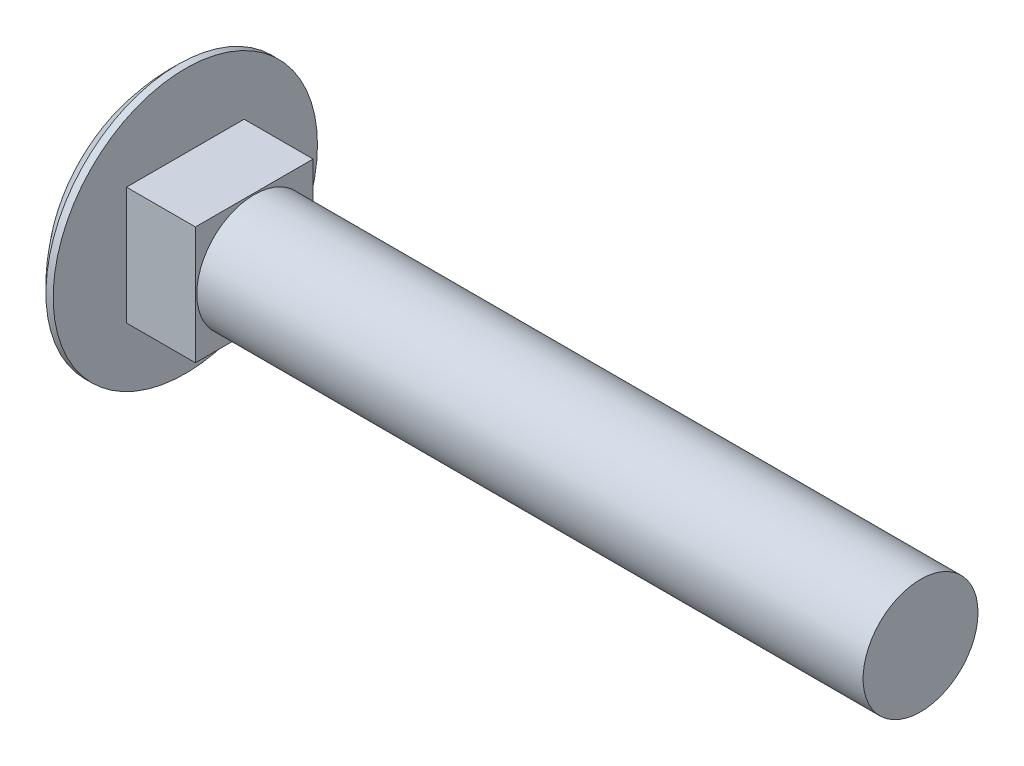
from build123d import *

# Parameters (mm, degrees)
SKETCH2_W           = 8.128
SKETCH2_H           = 8.128
BOSS_EXTRUDE1_DEPTH = 4.7625


with BuildPart() as part:
    # Sketch1 → Revolve1 (revolve)
    with BuildSketch(Plane.XY, mode=Mode.PRIVATE) as revolve1_sk:
        with BuildLine():
            Line((3.9704, 9.1313), (4.4704, 9.1313))
            Line((4.4704, 9.1313), (4.4704, 3.81))
            Line((4.4704, 3.81), (9.2329, 3.81))
            Line((9.2329, 3.81), (9.2329, 3.96875))
            Line((9.2329, 3.96875), (55.2704, 3.96875))
            Line((55.2704, 3.96875), (55.2704, 0))
            Line((55.2704, 0), (0, 0))
            ThreePointArc((0, 0), (1.035543925, 4.97857198), (3.9704, 9.1313))
        make_face()
    revolve(revolve1_sk.sketch.rotate(Axis((0, 0, 0), (-1, 0, 0)), 90), axis=Axis((0, 0, 0), (-1, 0, 0)))

    # Sketch2 → Boss-Extrude1 (add)
    with BuildSketch(Plane(origin=(4.4704, 0, 0), x_dir=(0, 0, -1), z_dir=(1, 0, 0))):
        Rectangle(SKETCH2_W, SKETCH2_H)
    extrude(amount=BOSS_EXTRUDE1_DEPTH)


solid = part.part
